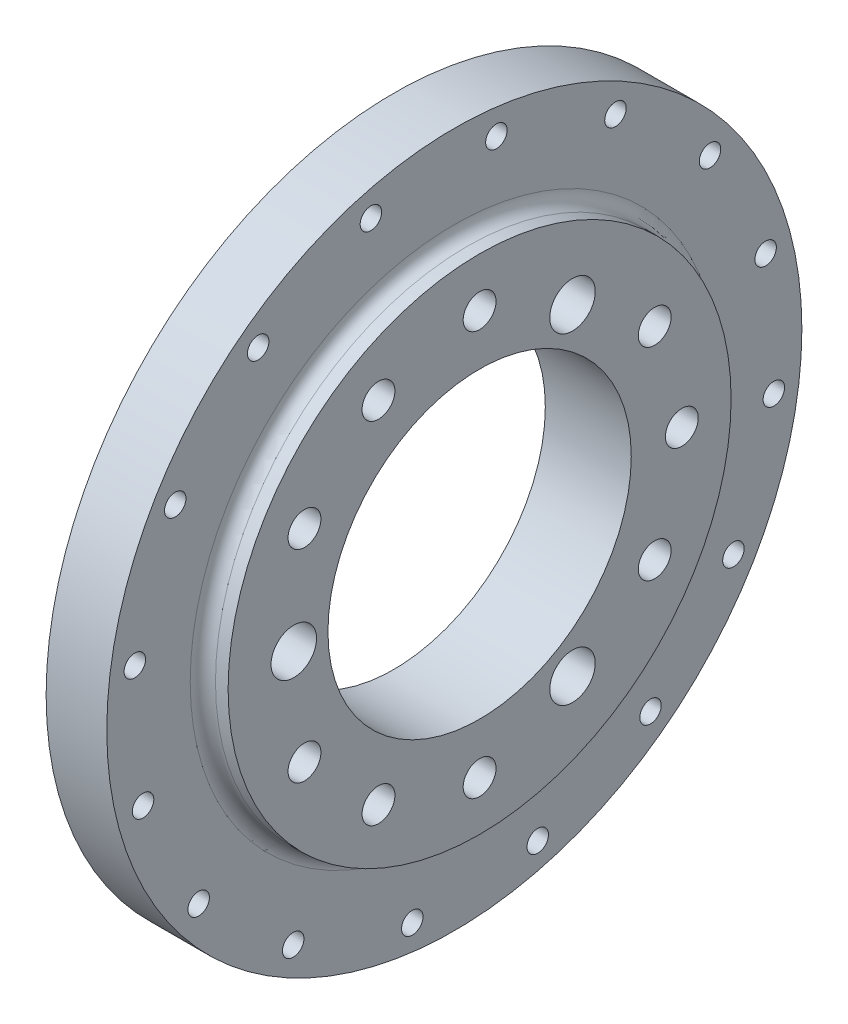
from build123d import *

# Parameters (mm, degrees)
CIRPATTERN2_COUNT  = 16
FILLET1_R          = 5
SKETCH7_R          = 9
CUT_EXTRUDE1_DEPTH = 198.404407246
SKETCH3_R          = 6.5
CUT_EXTRUDE2_DEPTH = 198.404407246


with BuildPart() as part:
    # Sketch1 → Revolve1 (revolve)
    with BuildSketch(Plane.XY, mode=Mode.PRIVATE) as revolve1_sk:
        Polygon((24, 137.5), (24, 99.5), (34, 99.5), (34, 60), (0, 60), (0, 137.5), align=None)
    revolve(revolve1_sk.sketch.rotate(Axis((0, 0, 0), (1, 0, 0)), 90), axis=Axis((0, 0, 0), (1, 0, 0)))

    # Sketch6 → M10 Tapped Hole1 (revolve, cut)
    with BuildSketch(Plane(origin=(0, -110.418238983, 63.75), x_dir=(0, 0, 1), z_dir=(0, 1, 0))):
        Polygon((0, 0), (0, 41.053657631), (4.25, 38.5), (4.25, 0.775), (5.025, 0), align=None)
    m10_tapped_hole1 = revolve(axis=Axis((-6.35, -110.418238983, 63.75), (1, 0, 0)), mode=Mode.SUBTRACT)

    # CirPattern2: M10 Tapped Hole1 ×16 about axis
    cirpattern2_axis = Axis((0, 0, 0), (1, 0, 0))
    for i in range(1, CIRPATTERN2_COUNT):
        add(m10_tapped_hole1.rotate(cirpattern2_axis, i * 360 / CIRPATTERN2_COUNT), mode=Mode.SUBTRACT)

    # Fillet1
    fillet1_edges = [part.edges().sort_by_distance(p)[0] for p in [
        (24, 0, -99.5),
    ]]
    fillet(fillet1_edges, radius=FILLET1_R)

    # Sketch7 → Cut-Extrude1 (cut, through all)
    with BuildSketch(Plane.ZY):
        with Locations((73.5, 0)):
            Circle(SKETCH7_R)
        with Locations((-36.75, -63.652867178)):
            Circle(SKETCH7_R)
        with Locations((-36.75, 63.652867178)):
            Circle(SKETCH7_R)
    extrude(amount=-CUT_EXTRUDE1_DEPTH, mode=Mode.SUBTRACT)

    # Sketch3 → Cut-Extrude2 (cut, through all)
    with BuildSketch(Plane.ZY):
        with Locations((0, 80)):
            Circle(SKETCH3_R)
        with Locations((40, 69.282032303)):
            Circle(SKETCH3_R)
        with Locations((69.282032303, 40)):
            Circle(SKETCH3_R)
        with Locations((69.282032303, -40)):
            Circle(SKETCH3_R)
        with Locations((40, -69.282032303)):
            Circle(SKETCH3_R)
        with Locations((0, -80)):
            Circle(SKETCH3_R)
        with Locations((-69.282032303, -40)):
            Circle(SKETCH3_R)
        with Locations((-80, 0)):
            Circle(SKETCH3_R)
        with Locations((-69.282032303, 40)):
            Circle(SKETCH3_R)
    extrude(amount=-CUT_EXTRUDE2_DEPTH, mode=Mode.SUBTRACT)


solid = part.part
